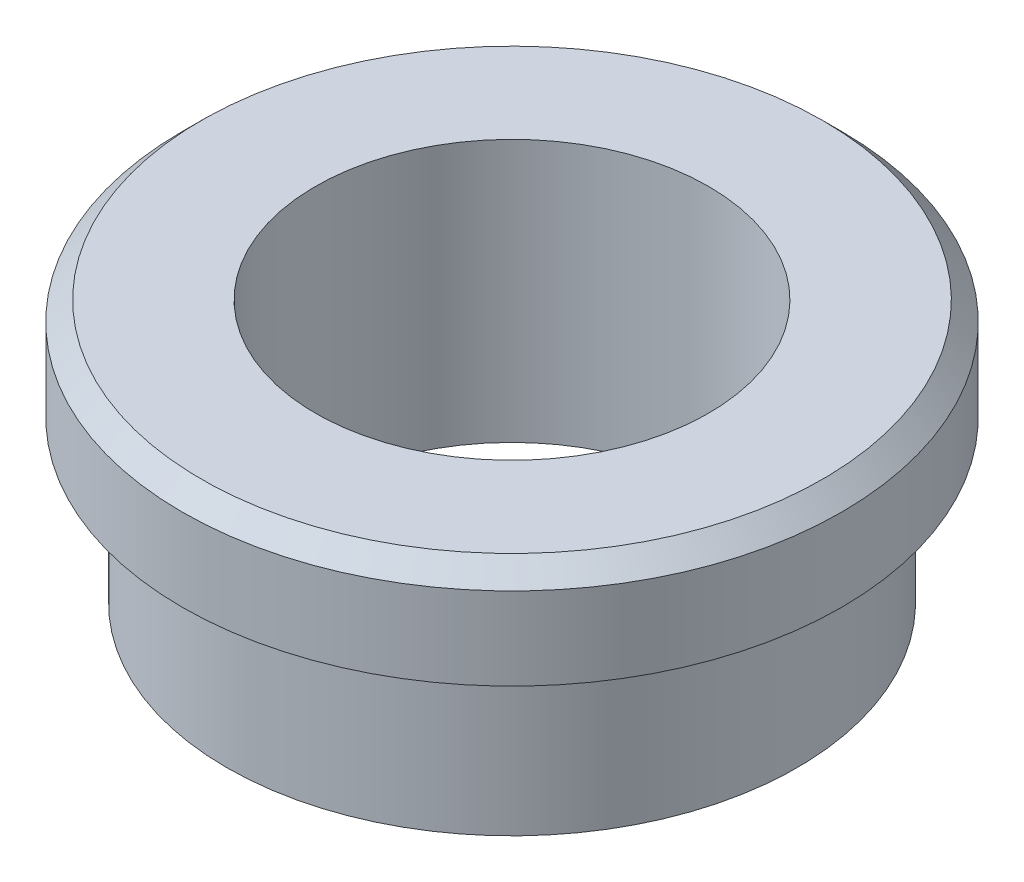
from build123d import *


with BuildPart() as part:
    # Esboço1 → Revolução1 (revolve)
    with BuildSketch(Plane.XY, mode=Mode.PRIVATE) as revolu_o1_sk:
        Polygon((15.5, 0), (15.5, 20.7), (24.5, 20.7), (26, 19.2), (26, 12.7), (22.5, 12.7), (22.5, 0), align=None)
    revolve(revolu_o1_sk.sketch.rotate(Axis((0, 0, 0), (0, 1, 0)), 90), axis=Axis((0, 0, 0), (0, 1, 0)))


solid = part.part
